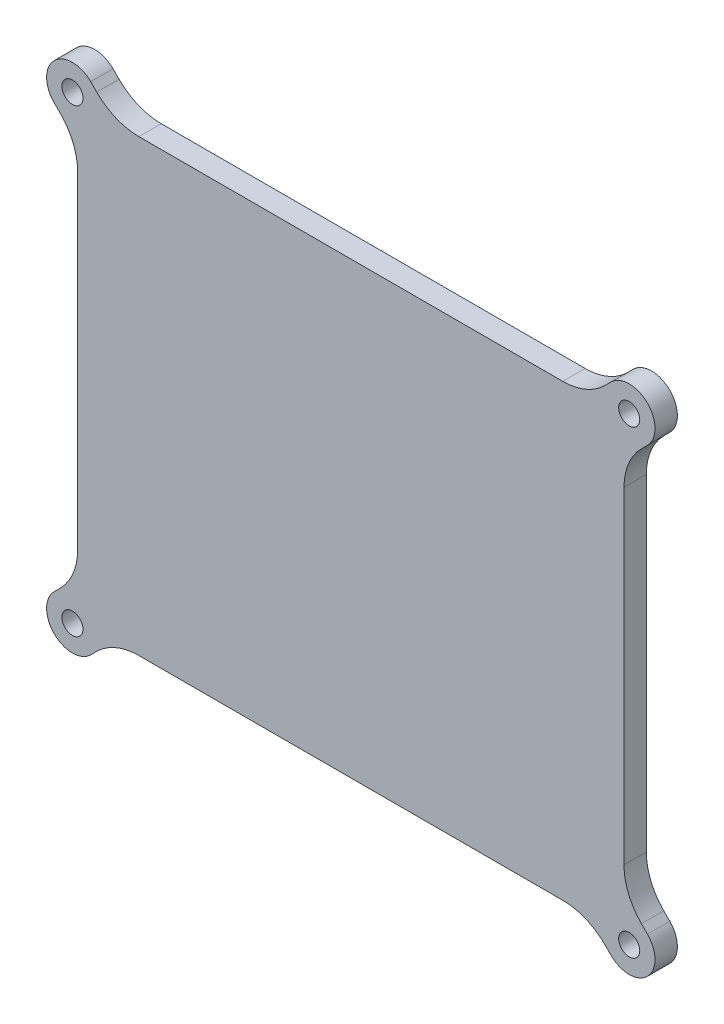
from build123d import *

# Parameters (mm, degrees)
BOSS_EXTRUDE1_DEPTH  = 4.7625
M4_CLEARANCE_HOLE1_D = 4.5


with BuildPart() as part:
    # Sketch2 → Boss-Extrude1 (new body)
    with BuildSketch(Plane.XY):
        with BuildLine():
            Line((-63.385065828, 38.234139131), (-62.103242019, 36.952315321))
            ThreePointArc((-62.103242019, 36.952315321), (-59.350228077, 32.832138791), (-58.38349814, 27.9720592))
            Line((-58.38349814, 27.9720592), (-58.38349814, -41.67556713))
            ThreePointArc((-58.38349814, -41.67556713), (-59.350228077, -46.535646721), (-62.103242019, -50.655823251))
            Line((-62.103242019, -50.655823251), (-63.385065828, -51.93764706))
            ThreePointArc((-63.385065828, -51.93764706), (-63.385065828, -59.715821653), (-55.606891235, -59.715821653))
            Line((-55.606891235, -59.715821653), (-54.325067426, -58.433997844))
            ThreePointArc((-54.325067426, -58.433997844), (-50.204890896, -55.680983902), (-45.344811305, -54.714253965))
            Line((-45.344811305, -54.714253965), (44.940315025, -54.714253965))
            ThreePointArc((44.940315025, -54.714253965), (49.800394616, -55.680983902), (53.920571146, -58.433997844))
            Line((53.920571146, -58.433997844), (55.202394956, -59.715821653))
            ThreePointArc((55.202394956, -59.715821653), (62.980569549, -59.715821653), (62.980569549, -51.93764706))
            Line((62.980569549, -51.93764706), (61.698745739, -50.655823251))
            ThreePointArc((61.698745739, -50.655823251), (58.945731797, -46.535646721), (57.97900186, -41.67556713))
            Line((57.97900186, -41.67556713), (57.97900186, 27.9720592))
            ThreePointArc((57.97900186, 27.9720592), (58.945731797, 32.832138791), (61.698745739, 36.952315321))
            Line((61.698745739, 36.952315321), (62.980569549, 38.234139131))
            ThreePointArc((62.980569549, 38.234139131), (62.980569549, 46.012313724), (55.202394956, 46.012313724))
            Line((55.202394956, 46.012313724), (53.920571146, 44.730489914))
            ThreePointArc((53.920571146, 44.730489914), (49.800394616, 41.977475972), (44.940315025, 41.010746035))
            Line((44.940315025, 41.010746035), (-45.344811305, 41.010746035))
            ThreePointArc((-45.344811305, 41.010746035), (-50.204890896, 41.977475972), (-54.325067426, 44.730489914))
            Line((-54.325067426, 44.730489914), (-55.606891235, 46.012313724))
            ThreePointArc((-55.606891235, 46.012313724), (-63.385065828, 46.012313724), (-63.385065828, 38.234139131))
        make_face()
    extrude(amount=BOSS_EXTRUDE1_DEPTH)

    # M4 Clearance Hole1 (through all)
    with Locations(Plane.XY.offset(4.7625)):
        with Locations((-59.495978532, -55.826734357), (-59.495978532, 42.123226427), (59.091482252, 42.123226427), (59.091482252, -55.826734357)):
            Hole(M4_CLEARANCE_HOLE1_D / 2)


solid = part.part
